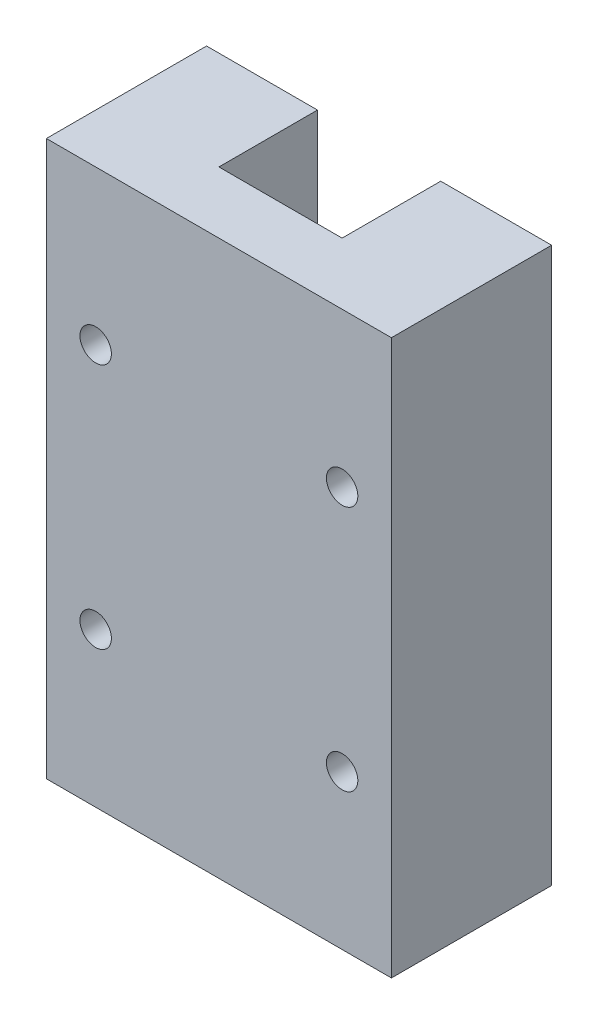
from build123d import *

# Parameters (mm, degrees)
BOSS_EXTRUDE1_DEPTH = 45
CUT_EXTRUDE1_REACH  = 50.888
SKETCH2_R           = 1.274102828


with BuildPart() as part:
    # Sketch1 → Boss-Extrude1 (new body)
    with BuildSketch(Plane(origin=(0, 0, 0), x_dir=(1, 0, 0), z_dir=(0, 1, 0))):
        Polygon((-5, 13), (-14, 13), (-14, 0), (14, 0), (14, 13), (5, 13), (5, 5), (-5, 5), align=None)
    extrude(amount=BOSS_EXTRUDE1_DEPTH)

    # Sketch2 → Cut-Extrude1 (cut, up to next)
    with BuildSketch(Plane.XY, mode=Mode.PRIVATE) as cut_extrude1_sk1:
        with Locations((-10, 32.5)):
            Circle(SKETCH2_R)
    cut_extrude1_tool1 = extrude(cut_extrude1_sk1.sketch, amount=-CUT_EXTRUDE1_REACH, mode=Mode.PRIVATE) & part.part
    # Sketch2 → Cut-Extrude1 (cut, up to next)
    with BuildSketch(Plane.XY, mode=Mode.PRIVATE) as cut_extrude1_sk2:
        with Locations((10, 32.5)):
            Circle(SKETCH2_R)
    cut_extrude1_tool2 = extrude(cut_extrude1_sk2.sketch, amount=-CUT_EXTRUDE1_REACH, mode=Mode.PRIVATE) & part.part
    # Sketch2 → Cut-Extrude1 (cut, up to next)
    with BuildSketch(Plane.XY, mode=Mode.PRIVATE) as cut_extrude1_sk3:
        with Locations((10, 12.5)):
            Circle(SKETCH2_R)
    cut_extrude1_tool3 = extrude(cut_extrude1_sk3.sketch, amount=-CUT_EXTRUDE1_REACH, mode=Mode.PRIVATE) & part.part
    # Sketch2 → Cut-Extrude1 (cut, up to next)
    with BuildSketch(Plane.XY, mode=Mode.PRIVATE) as cut_extrude1_sk4:
        with Locations((-10, 12.5)):
            Circle(SKETCH2_R)
    cut_extrude1_tool4 = extrude(cut_extrude1_sk4.sketch, amount=-CUT_EXTRUDE1_REACH, mode=Mode.PRIVATE) & part.part
    add(cut_extrude1_tool1.solids().sort_by_distance((-10, 32.5, 0))[0], mode=Mode.SUBTRACT)
    add(cut_extrude1_tool2.solids().sort_by_distance((10, 32.5, 0))[0], mode=Mode.SUBTRACT)
    add(cut_extrude1_tool3.solids().sort_by_distance((10, 12.5, 0))[0], mode=Mode.SUBTRACT)
    add(cut_extrude1_tool4.solids().sort_by_distance((-10, 12.5, 0))[0], mode=Mode.SUBTRACT)


solid = part.part
